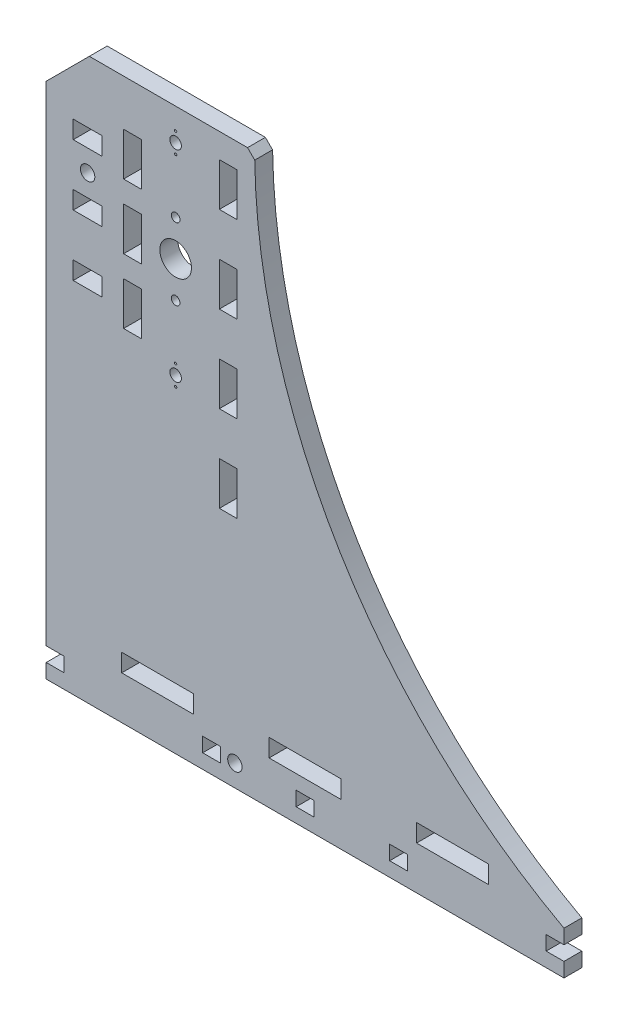
from build123d import *

# Parameters (mm, degrees)
SKETCH1_R           = 5
SKETCH1_R_2         = 11
SKETCH1_R_3         = 3
SKETCH1_R_4         = 4
SKETCH1_R_5         = 0.8
SKETCH1_W           = 12.4
SKETCH1_H           = 10
SKETCH1_W_2         = 50
SKETCH1_H_2         = 12.4
SKETCH1_H_3         = 30
SKETCH1_W_3         = 20
BOSS_EXTRUDE1_DEPTH = 12.4


with BuildPart() as part:
    # Sketch1 → Boss-Extrude1 (new body)
    with BuildSketch(Plane.XY):
        with BuildLine():
            Line((-180, 0), (180, 0))
            Line((180, 0), (180, 10))
            Line((180, 10), (167.6, 10))
            Line((167.6, 10), (167.6, 20))
            Line((167.6, 20), (180, 20))
            Line((180, 20), (180, 30))
            ThreePointArc((180, 30), (24.399116368, 178.368906186), (-35.000570148, 385.000570148))
            Line((-35.000570148, 385.000570148), (-40, 390))
            Line((-40, 390), (-140, 390))
            Line((-140, 390), (-150, 390))
            Line((-150, 390), (-180, 360))
            Line((-180, 360), (-180, 30))
            Line((-180, 30), (-180, 20))
            Line((-180, 20), (-167.6, 20))
            Line((-167.6, 20), (-167.6, 10))
            Line((-167.6, 10), (-180, 10))
            Line((-180, 10), (-180, 0))
        make_face()
        with Locations(Location((-151.2, 319.2, 0), (0, 0, 180))):
            Circle(SKETCH1_R, mode=Mode.SUBTRACT)
        with Locations(Location((-90, 298, 0), (0, 0, 180))):
            Circle(SKETCH1_R_2, mode=Mode.SUBTRACT)
        with Locations(Location((-90, 323, 0), (0, 0, 180))):
            Circle(SKETCH1_R_3, mode=Mode.SUBTRACT)
        with Locations(Location((-90, 368, 0), (0, 0, 180))):
            Circle(SKETCH1_R_4, mode=Mode.SUBTRACT)
        with Locations(Location((-90, 375, 0), (0, 0, 180))):
            Circle(SKETCH1_R_5, mode=Mode.SUBTRACT)
        with Locations(Location((-90, 361, 0), (0, 0, 180))):
            Circle(SKETCH1_R_5, mode=Mode.SUBTRACT)
        with Locations(Location((-90, 221, 0), (0, 0, 180))):
            Circle(SKETCH1_R_5, mode=Mode.SUBTRACT)
        with Locations(Location((-90, 228, 0), (0, 0, 180))):
            Circle(SKETCH1_R_4, mode=Mode.SUBTRACT)
        with Locations(Location((-90, 235, 0), (0, 0, 180))):
            Circle(SKETCH1_R_5, mode=Mode.SUBTRACT)
        with Locations(Location((-90, 273, 0), (0, 0, 180))):
            Circle(SKETCH1_R_3, mode=Mode.SUBTRACT)
        with Locations(Location((-48.8, 15, 0), (0, 0, 180))):
            Circle(SKETCH1_R, mode=Mode.SUBTRACT)
        with Locations((65, 15)):
            Rectangle(SKETCH1_W, SKETCH1_H, mode=Mode.SUBTRACT)
        with Locations((0, 15)):
            Rectangle(SKETCH1_W, SKETCH1_H, mode=Mode.SUBTRACT)
        with Locations((-65, 15)):
            Rectangle(SKETCH1_W, SKETCH1_H, mode=Mode.SUBTRACT)
        with Locations((102.5, 36.2)):
            Rectangle(SKETCH1_W_2, SKETCH1_H_2, mode=Mode.SUBTRACT)
        with Locations((0, 36.2)):
            Rectangle(SKETCH1_W_2, SKETCH1_H_2, mode=Mode.SUBTRACT)
        with Locations((-102.5, 36.2)):
            Rectangle(SKETCH1_W_2, SKETCH1_H_2, mode=Mode.SUBTRACT)
        with Locations((-120, 298)):
            Rectangle(SKETCH1_W, SKETCH1_H_3, mode=Mode.SUBTRACT)
        with Locations((-120, 343)):
            Rectangle(SKETCH1_W, SKETCH1_H_3, mode=Mode.SUBTRACT)
        with Locations((-120, 253)):
            Rectangle(SKETCH1_W, SKETCH1_H_3, mode=Mode.SUBTRACT)
        with Locations((-151.2, 340.4)):
            Rectangle(SKETCH1_W_3, SKETCH1_H_2, mode=Mode.SUBTRACT)
        with Locations((-151.2, 298)):
            Rectangle(SKETCH1_W_3, SKETCH1_H_2, mode=Mode.SUBTRACT)
        with Locations((-151.2, 255.6)):
            Rectangle(SKETCH1_W_3, SKETCH1_H_2, mode=Mode.SUBTRACT)
        with Locations((-53.4, 358)):
            Rectangle(SKETCH1_W, SKETCH1_H_3, mode=Mode.SUBTRACT)
        with Locations((-53.4, 298)):
            Rectangle(SKETCH1_W, SKETCH1_H_3, mode=Mode.SUBTRACT)
        with Locations((-53.4, 238)):
            Rectangle(SKETCH1_W, SKETCH1_H_3, mode=Mode.SUBTRACT)
        with Locations((-53.4, 178)):
            Rectangle(SKETCH1_W, SKETCH1_H_3, mode=Mode.SUBTRACT)
    extrude(amount=BOSS_EXTRUDE1_DEPTH)


solid = part.part
